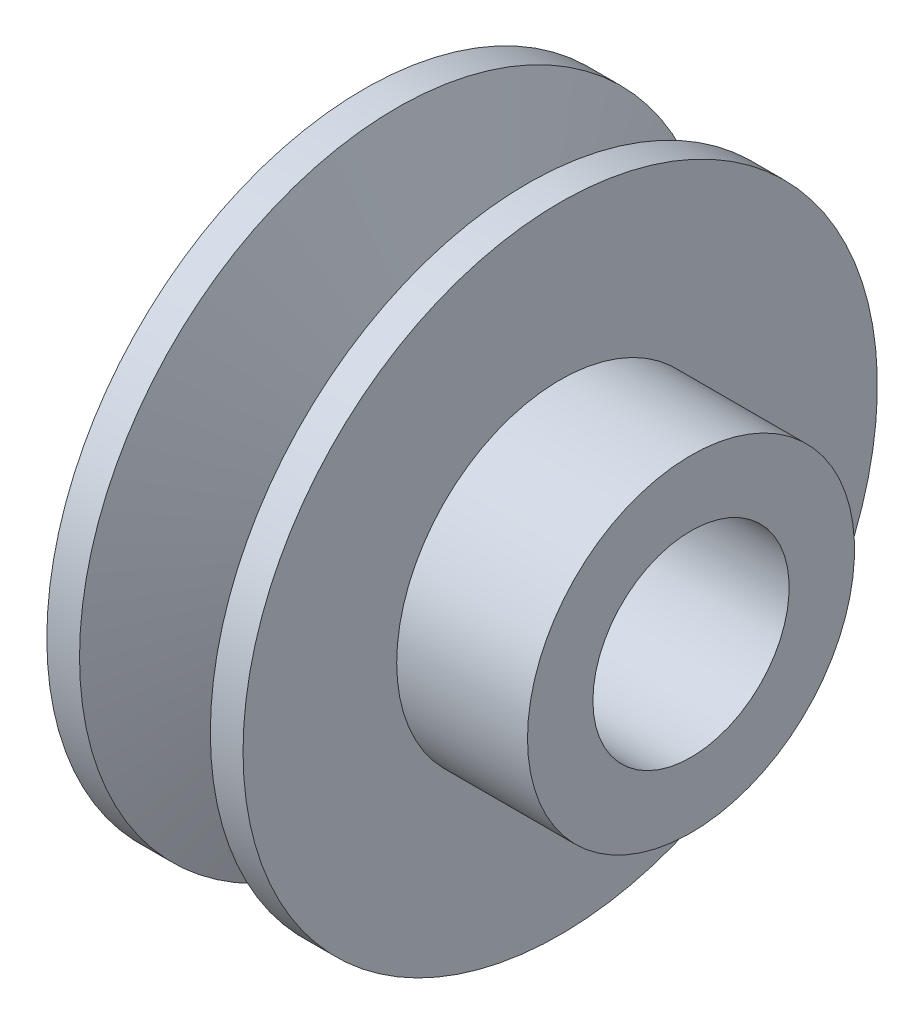
from build123d import *

# Parameters (mm, degrees)
SKETCH1_W = 8.257122183
SKETCH1_H = 10
SKETCH1_R = 1.5


with BuildPart() as part:
    # Sketch1 → Revolve10 (revolve)
    with BuildSketch(Plane(origin=(0, 0, 0), x_dir=(1, 0, 0), z_dir=(0, 1, 0)), mode=Mode.PRIVATE) as revolve10_sk:
        Polygon((0, 48.49231552), (0, 0), (5, 0), (5, 15), (38.242877817, 15), (38.242877817, 25), (30, 25), (30, 48.49231552), (25, 48.49231552), (16.449496417, 25), (13.550503583, 25), (5, 48.49231552), align=None)
        with Locations((45.871438908, 20)):
            Rectangle(SKETCH1_W, SKETCH1_H)
        Polygon((38.242877817, 25), (38.242877817, 15), (39.242877817, 15), (40.742877817, 15), (41.742877817, 15), (41.742877817, 25), (40.75, 25), (40.742877817, 25), (39.25, 25), (39.242877817, 25), align=None)
        with Locations((40, 20.511791121)):
            Circle(SKETCH1_R, mode=Mode.SUBTRACT)
    revolve(revolve10_sk.sketch.rotate(Axis((0, 0, 0), (1, 0, 0)), 180), axis=Axis((0, 0, 0), (1, 0, 0)))


solid = part.part
